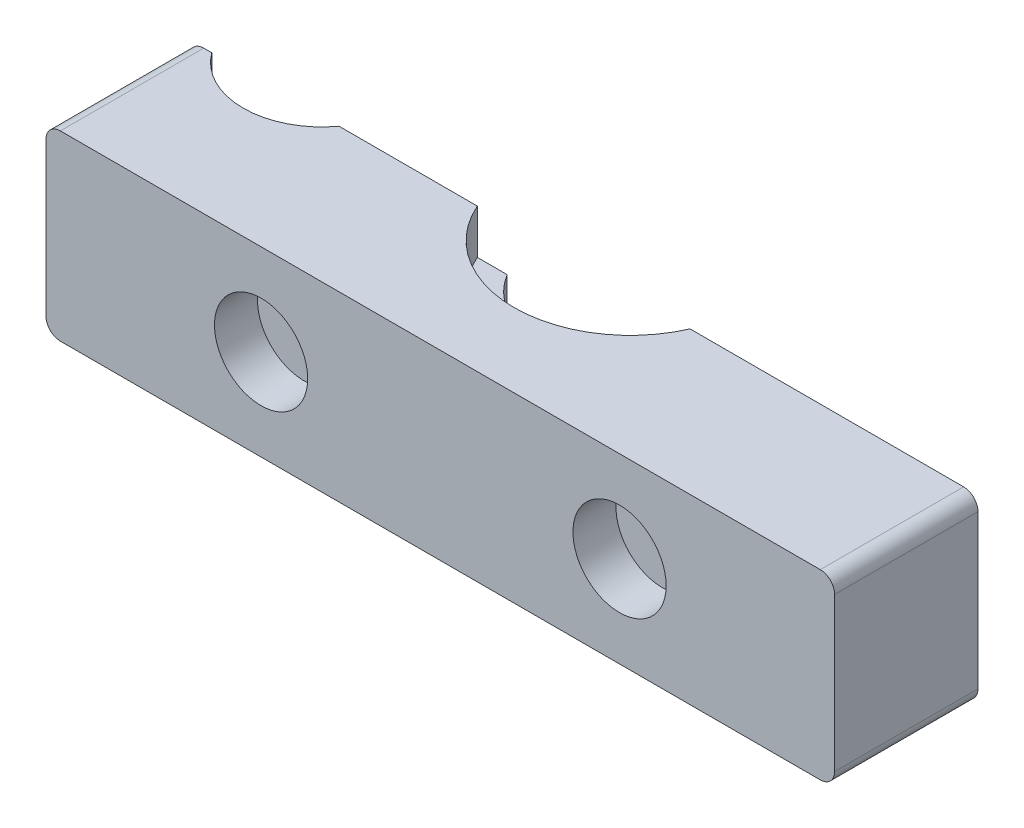
from build123d import *

# Parameters (mm, degrees)
SKETCH1_W           = 55
SKETCH1_H           = 12.7
BOSS_EXTRUDE1_DEPTH = 10
CUT_EXTRUDE1_DEPTH  = 32.898902802
SKETCH6_W           = 8.1
SKETCH6_H           = 3.1
SKETCH6_H_2         = 4
SKETCH7_R           = 1.75
CUT_EXTRUDE2_DEPTH  = 6.5
SKETCH8_R           = 3.25
CUT_EXTRUDE3_DEPTH  = 3
FILLET1_R           = 1


with BuildPart() as part:
    # Sketch1 → Boss-Extrude1 (new body)
    with BuildSketch(Plane.XY):
        Rectangle(SKETCH1_W, SKETCH1_H)
    extrude(amount=BOSS_EXTRUDE1_DEPTH)

    # Sketch2 → Cut-Extrude1 (cut, through all)
    with BuildSketch(Plane(origin=(0, 6.35, 0), x_dir=(1, 0, 0), z_dir=(0, 1, 0))):
        with BuildLine():
            Line((5.338539126, 0), (-5.338539126, 0))
            ThreePointArc((-5.338539126, 0), (0, -3), (5.338539126, 0))
        make_face()
        with BuildLine():
            Line((-17.062940163, 0), (-25.937059837, 0))
            ThreePointArc((-25.937059837, 0), (-21.5, -2.25), (-17.062940163, 0))
        make_face()
    extrude(amount=-CUT_EXTRUDE1_DEPTH, mode=Mode.SUBTRACT)

    # Sketch6 → Cut-Revolve1 (revolve, cut)
    with BuildSketch(Plane(origin=(0, 0, -3.25), x_dir=(-1, 0, 0), z_dir=(0, 0, -1))):
        with Locations((4.05, 4.8)):
            Rectangle(SKETCH6_W, SKETCH6_H)
        with Locations((4.05, -4.35)):
            Rectangle(SKETCH6_W, SKETCH6_H_2)
    revolve(axis=Axis((0, -6.35, -3.25), (0, 1, 0)), mode=Mode.SUBTRACT)

    # Sketch7 → Cut-Extrude2 (cut)
    with BuildSketch(Plane(origin=(0, 0, 0), x_dir=(-1, 0, 0), z_dir=(0, 0, -1))):
        with Locations((12.5, 0)):
            Circle(SKETCH7_R)
        with Locations((-12.5, 0)):
            Circle(SKETCH7_R)
    extrude(amount=-CUT_EXTRUDE2_DEPTH, mode=Mode.SUBTRACT)

    # Sketch8 → Cut-Extrude3 (cut)
    with BuildSketch(Plane.XY.offset(10)):
        with Locations((-12.5, 0)):
            Circle(SKETCH8_R)
        with Locations((12.5, 0)):
            Circle(SKETCH8_R)
    extrude(amount=-CUT_EXTRUDE3_DEPTH, mode=Mode.SUBTRACT)

    # Fillet1
    fillet1_edges = [part.edges().sort_by_distance(p)[0] for p in [
        (-27.5, 6.35, 5),
        (27.5, 6.35, 5),
        (27.5, -6.35, 5),
        (-27.5, -6.35, 5),
    ]]
    fillet(fillet1_edges, radius=FILLET1_R)


solid = part.part
